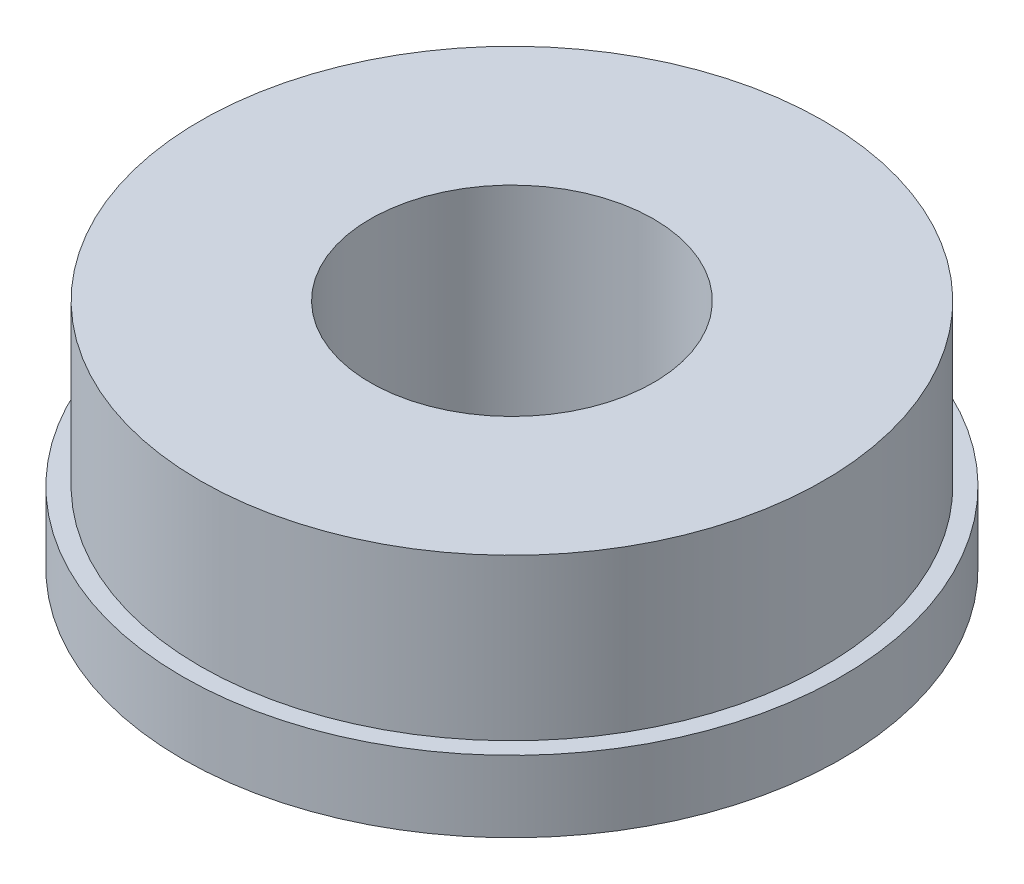
from build123d import *

# Parameters (mm, degrees)
SKETCH1_R           = 17.465
SKETCH1_R_2         = 7.94
BOSS_EXTRUDE1_DEPTH = 13
SKETCH2_R           = 18.465
SKETCH2_R_2         = 7.94
BOSS_EXTRUDE3_DEPTH = 4


with BuildPart() as part:
    # Sketch1 → Boss-Extrude1 (new body)
    with BuildSketch(Plane(origin=(0, 0, 0), x_dir=(1, 0, 0), z_dir=(0, 1, 0))):
        with Locations(Location((0, 0, 0), (0, 0, 90))):
            Circle(SKETCH1_R)
        with Locations(Location((0, 0, 0), (0, 0, 90))):
            Circle(SKETCH1_R_2, mode=Mode.SUBTRACT)
    extrude(amount=BOSS_EXTRUDE1_DEPTH)

    # Sketch2 → Boss-Extrude3 (add)
    with BuildSketch(Plane(origin=(0, 0, 0), x_dir=(1, 0, 0), z_dir=(0, 1, 0))):
        with Locations(Location((0, 0, 0), (0, 0, 270))):
            Circle(SKETCH2_R)
        with Locations(Location((0, 0, 0), (0, 0, 90))):
            Circle(SKETCH2_R_2, mode=Mode.SUBTRACT)
    extrude(amount=BOSS_EXTRUDE3_DEPTH)


solid = part.part
